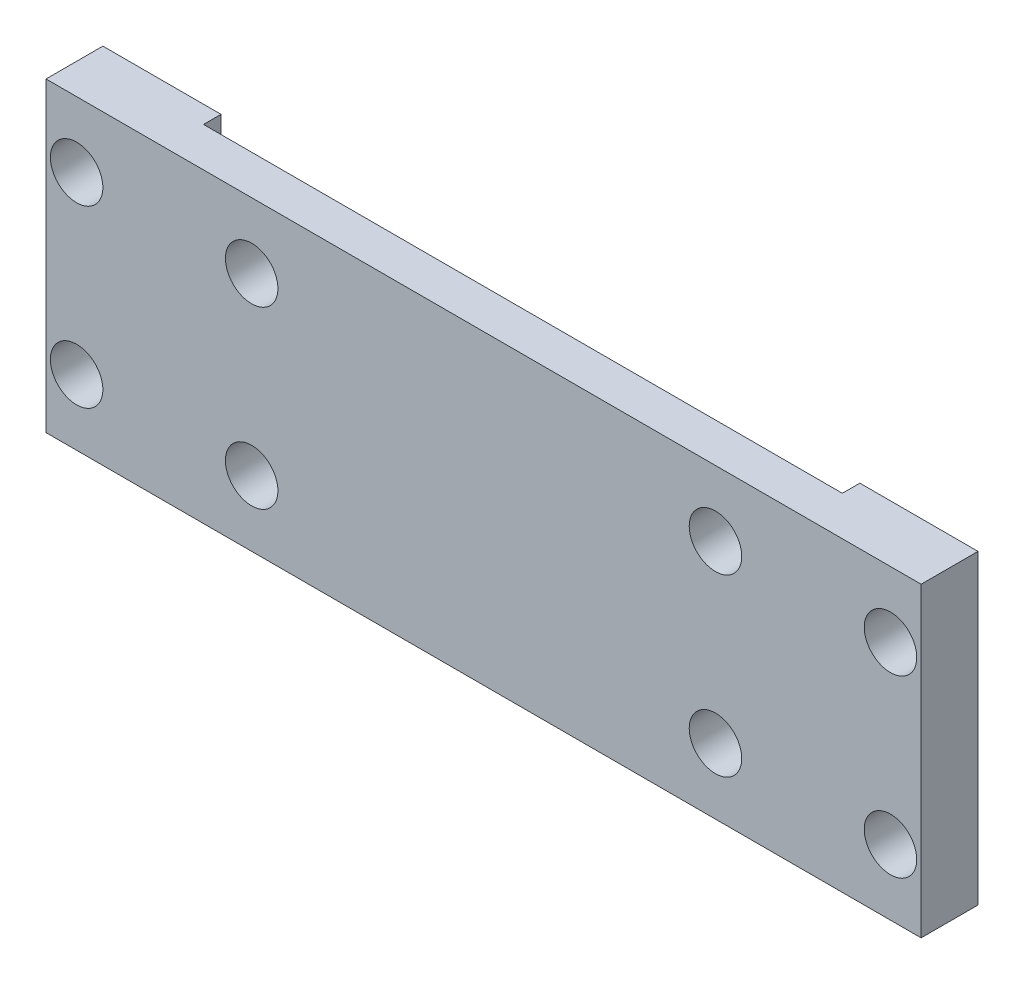
from build123d import *

# Parameters (mm, degrees)
ESQUISSE1_W          = 13.5
ESQUISSE1_H          = 35
ESQUISSE1_R          = 1.75
BOSS_EXTRU_1_DEPTH   = 2
BOSS_EXTRU_1_2_DEPTH = 2
ESQUISSE2_W          = 100
ESQUISSE2_H          = 35
ESQUISSE2_R          = 3
BOSS_EXTRU_2_DEPTH   = 4.5


with BuildPart() as part:
    # Esquisse1 → Boss.-Extru.1 (new body)
    with BuildSketch(Plane.XY):
        with Locations((-43.25, -17.5)):
            Rectangle(ESQUISSE1_W, ESQUISSE1_H)
        with Locations((-46.5, -7.5)):
            Circle(ESQUISSE1_R, mode=Mode.SUBTRACT)
        with Locations((-46.5, -27.5)):
            Circle(ESQUISSE1_R, mode=Mode.SUBTRACT)
    extrude(amount=BOSS_EXTRU_1_DEPTH)



with BuildPart() as body_2:
    # Esquisse1 → Boss.-Extru.1 2 (new body)
    with BuildSketch(Plane.XY):
        with Locations((43.25, -17.5)):
            Rectangle(ESQUISSE1_W, ESQUISSE1_H)
        with Locations(Location((46.5, -27.5, 0), (0, 0, 180))):
            Circle(ESQUISSE1_R, mode=Mode.SUBTRACT)
        with Locations(Location((46.5, -7.5, 0), (0, 0, 180))):
            Circle(ESQUISSE1_R, mode=Mode.SUBTRACT)
    extrude(amount=BOSS_EXTRU_1_2_DEPTH)


with BuildPart() as part_1:
    add(part.part)

    add(body_2.part)  # Boss.-Extru.2 merges body 2
    # Esquisse2 → Boss.-Extru.2 (add)
    with BuildSketch(Plane.XY.offset(2)):
        with Locations((0, -17.5)):
            Rectangle(ESQUISSE2_W, ESQUISSE2_H)
        with Locations((-46.5, -7.5)):
            Circle(ESQUISSE2_R, mode=Mode.SUBTRACT)
        with Locations((-46.5, -27.5)):
            Circle(ESQUISSE2_R, mode=Mode.SUBTRACT)
        with Locations((46.5, -7.5)):
            Circle(ESQUISSE2_R, mode=Mode.SUBTRACT)
        with Locations((46.5, -27.5)):
            Circle(ESQUISSE2_R, mode=Mode.SUBTRACT)
        with Locations((-26.5, -7.5)):
            Circle(ESQUISSE2_R, mode=Mode.SUBTRACT)
        with Locations((-26.5, -27.5)):
            Circle(ESQUISSE2_R, mode=Mode.SUBTRACT)
        with Locations(Location((26.5, -27.5, 0), (0, 0, 180))):
            Circle(ESQUISSE2_R, mode=Mode.SUBTRACT)
        with Locations(Location((26.5, -7.5, 0), (0, 0, 180))):
            Circle(ESQUISSE2_R, mode=Mode.SUBTRACT)
    extrude(amount=BOSS_EXTRU_2_DEPTH)


solid = part_1.part
